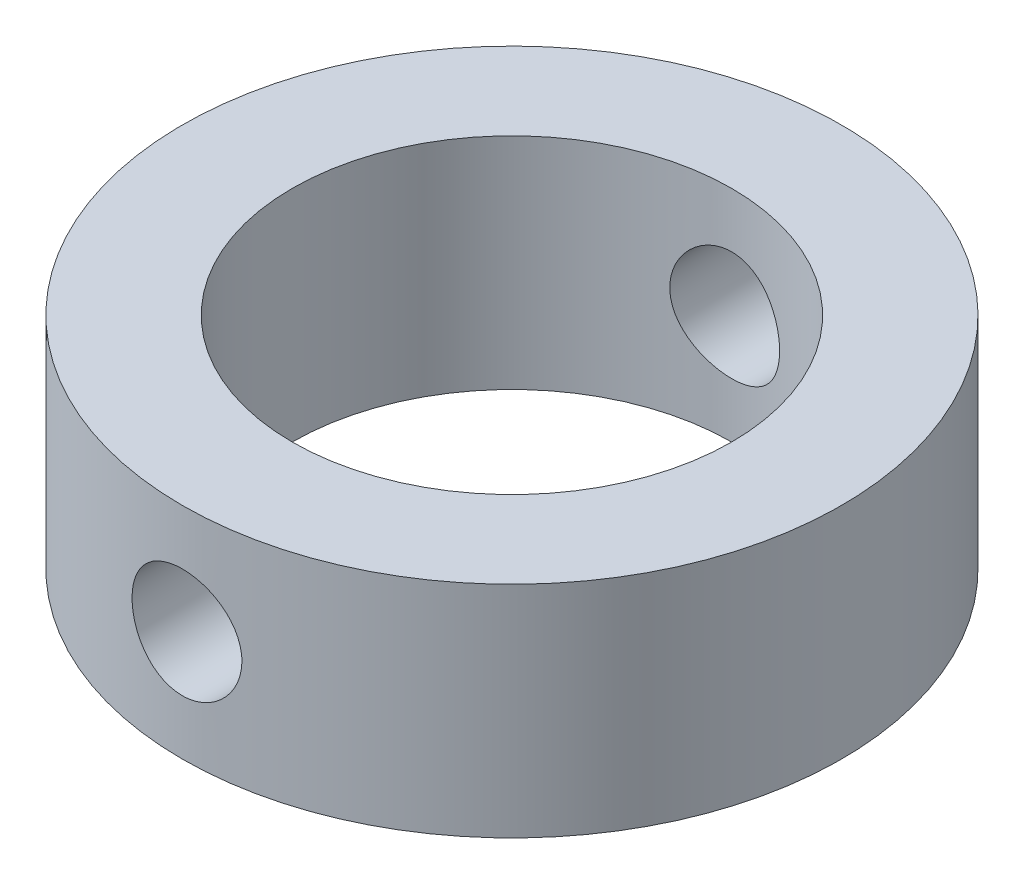
from build123d import *

# Parameters (mm, degrees)
SKETCH2_R               = 15
BOSS_EXTRUDE1_DEPTH     = 10
SKETCH3_R               = 10
CUT_EXTRUDE1_DEPTH      = 24.452078799
CUT_EXTRUDE2_DEPTH      = 24.452078799
CUT_EXTRUDE2_DEPTH_BACK = 24.452078799
SKETCH4_R               = 2.5


with BuildPart() as part:
    # Sketch2 → Boss-Extrude1 (new body)
    with BuildSketch(Plane(origin=(0, 0, 0), x_dir=(1, 0, 0), z_dir=(0, 1, 0))):
        with Locations(Location((0, 0, 0), (0, 0, 270))):
            Circle(SKETCH2_R)
    extrude(amount=BOSS_EXTRUDE1_DEPTH)

    # Sketch3 → Cut-Extrude1 (cut, through all)
    with BuildSketch(Plane(origin=(0, 10, 0), x_dir=(1, 0, 0), z_dir=(0, 1, 0))):
        with Locations(Location((0, 0, 0), (0, 0, 270))):
            Circle(SKETCH3_R)
    extrude(amount=-CUT_EXTRUDE1_DEPTH, mode=Mode.SUBTRACT)

    # Sketch4 → Cut-Extrude2 (cut, two sides: drawn at the far end of the back side and taken through both)
    with BuildSketch(Plane.XY.offset(-CUT_EXTRUDE2_DEPTH_BACK)):
        with Locations((0, 5)):
            Circle(SKETCH4_R)
    extrude(amount=CUT_EXTRUDE2_DEPTH + CUT_EXTRUDE2_DEPTH_BACK, mode=Mode.SUBTRACT)


solid = part.part
